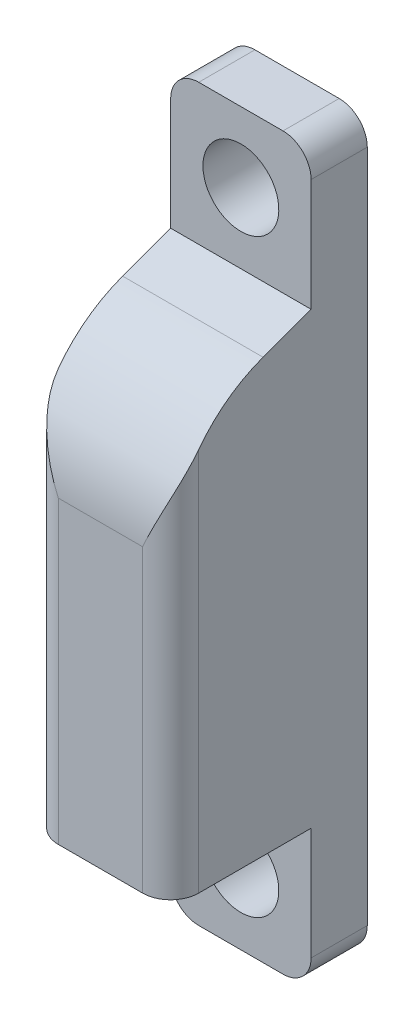
from build123d import *

# Parameters (mm, degrees)
SKETCH1_W                  = 5
SKETCH1_H                  = 26
EXTRUDE1_DEPTH             = 7
F_2_7_2_7_DIAMETER_HOLE1_D = 2.7
EXTRUDE3_REACH             = 17.588
SKETCH8_W                  = 5
SKETCH8_H                  = 5
FILLET1_R                  = 1
FILLET2_R                  = 1
EXTRUDE4_REACH             = 17.588


with BuildPart() as part:
    # Sketch1 → Extrude1 (new body)
    with BuildSketch(Plane.XY):
        Rectangle(SKETCH1_W, SKETCH1_H)
    extrude(amount=EXTRUDE1_DEPTH)

    # Ø2.7 (2.7) Diameter Hole1 (through all)
    with Locations(Plane(origin=(0, 0, 0), x_dir=(-1, 0, 0), z_dir=(0, 0, -1))):
        with Locations((0, 10.5), (0, -10.5)):
            Hole(F_2_7_2_7_DIAMETER_HOLE1_D / 2)

    # Extrude3: up to this face of the body (flat: up to its plane)
    extrude3_end = Plane(part.part.faces().sort_by_distance((-2.5, 0, 3.5))[0])
    # Sketch8 → Extrude3 (cut, up to the picked face)
    with BuildSketch(Plane(origin=(2.5, 0, 0), x_dir=(0, 0, -1), z_dir=(1, 0, 0)), mode=Mode.PRIVATE) as extrude3_sk1:
        with Locations((-4.5, -10.5)):
            Rectangle(SKETCH8_W, SKETCH8_H)
    extrude3_tool1 = split(extrude(extrude3_sk1.sketch, amount=-EXTRUDE3_REACH, mode=Mode.PRIVATE), bisect_by=extrude3_end, keep=Keep.BOTH, mode=Mode.PRIVATE)
    # Sketch8 → Extrude3 (cut, up to the picked face)
    with BuildSketch(Plane(origin=(2.5, 0, 0), x_dir=(0, 0, -1), z_dir=(1, 0, 0)), mode=Mode.PRIVATE) as extrude3_sk2:
        with Locations((-4.5, 10.5)):
            Rectangle(SKETCH8_W, SKETCH8_H)
    extrude3_tool2 = split(extrude(extrude3_sk2.sketch, amount=-EXTRUDE3_REACH, mode=Mode.PRIVATE), bisect_by=extrude3_end, keep=Keep.BOTH, mode=Mode.PRIVATE)
    add(extrude3_tool1.solids().sort_by(Axis((2.5, -10.5, 4.5), (-1, 0, 0)))[0], mode=Mode.SUBTRACT)
    add(extrude3_tool2.solids().sort_by(Axis((2.5, 10.5, 4.5), (-1, 0, 0)))[0], mode=Mode.SUBTRACT)

    # Fillet1
    fillet1_edges = [part.edges().sort_by_distance(p)[0] for p in [
        (2.5, 0, 7),
        (-2.5, 0, 7),
    ]]
    fillet(fillet1_edges, radius=FILLET1_R)

    # Fillet2
    fillet2_edges = [part.edges().sort_by_distance(p)[0] for p in [
        (2.5, -13, 1),
        (-2.5, -13, 1),
        (-2.5, 13, 1),
        (2.5, 13, 1),
    ]]
    fillet(fillet2_edges, radius=FILLET2_R)

    # Extrude4: up to this face of the body (flat: up to its plane)
    extrude4_end = Plane(part.part.faces().sort_by_distance((2.5, 0, 2.714285714))[0])
    # Sketch9 → Extrude4 (cut, up to the picked face)
    with BuildSketch(Plane.ZY.offset(2.5), mode=Mode.PRIVATE) as extrude4_sk1:
        with BuildLine():
            Line((2, 8), (3.710100717, 7.377574242))
            ThreePointArc((3.710100717, 7.377574242), (6.095760221, 5.546993319), (7, 2.679111138))
            Line((7, 2.679111138), (7, 8))
            Line((7, 8), (2, 8))
        make_face()
    extrude4_tool1 = split(extrude(extrude4_sk1.sketch, amount=-EXTRUDE4_REACH, mode=Mode.PRIVATE), bisect_by=extrude4_end, keep=Keep.BOTH, mode=Mode.PRIVATE)
    add(extrude4_tool1.solids().sort_by(Axis((-2.5, 6.831886, 5.650764), (1, 0, 0)))[0], mode=Mode.SUBTRACT)


solid = part.part
